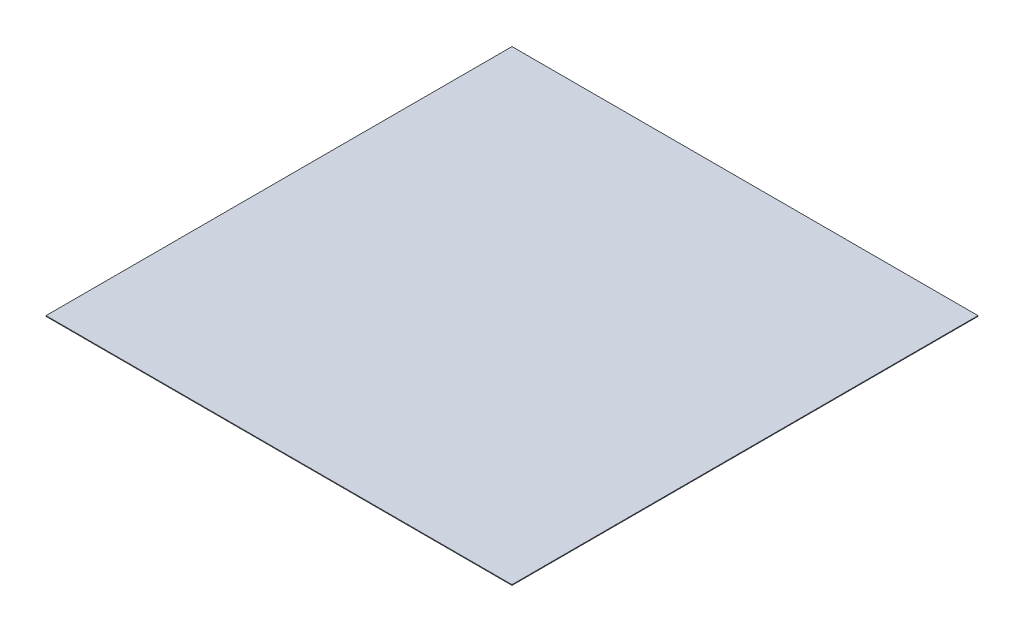
from build123d import *

# Parameters (mm, degrees)
SKETCH1_W           = 3400
SKETCH1_H           = 3400
BOSS_EXTRUDE1_DEPTH = 5


with BuildPart() as part:
    # Sketch1 → Boss-Extrude1 (new body)
    with BuildSketch(Plane(origin=(0, 0, 0), x_dir=(1, 0, 0), z_dir=(0, 1, 0))):
        Rectangle(SKETCH1_W, SKETCH1_H)
    extrude(amount=BOSS_EXTRUDE1_DEPTH)


solid = part.part
